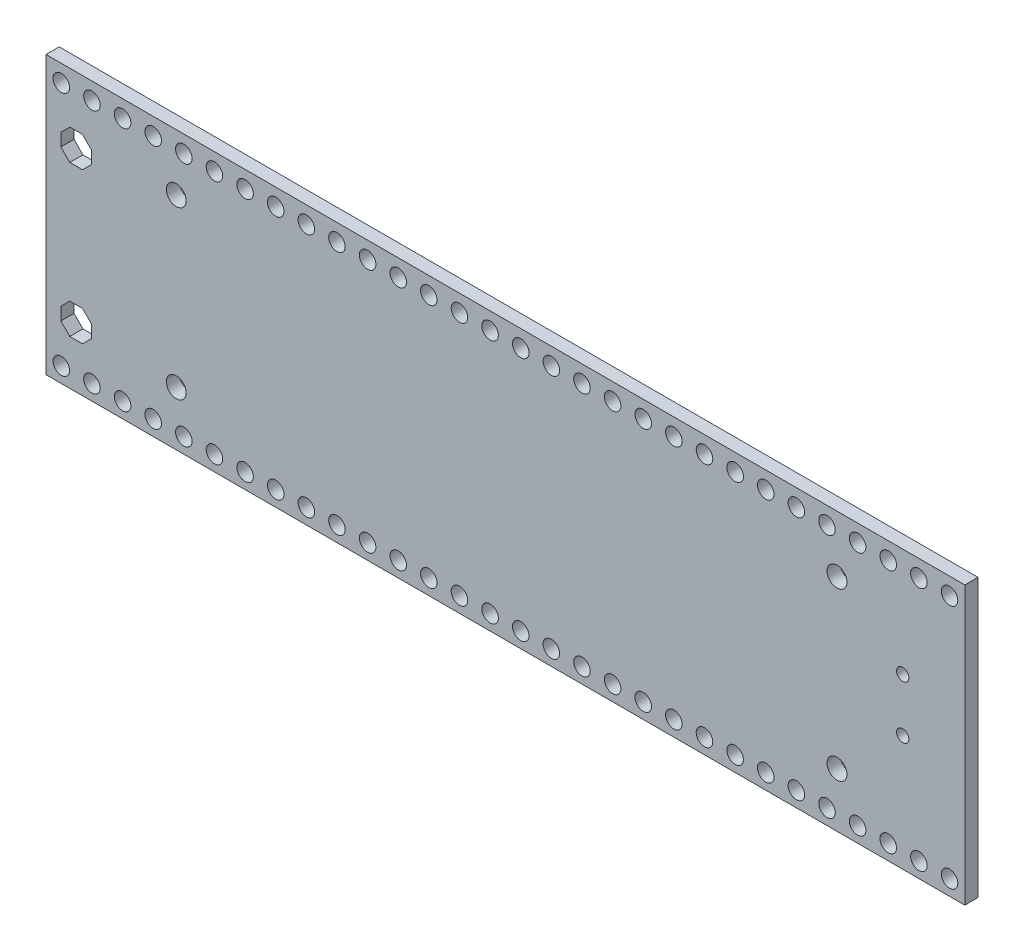
from build123d import *

# Parameters (mm, degrees)
MAIN_BOARD_DEPTH      = 0.5461
MAIN_BOARD_DEPTH_BACK = 0.5461
SKETCH1_W             = 76.2
SKETCH1_H             = 23.0000048
SKETCH1_R             = 0.6858
SKETCH1_R_2           = 0.824992
SKETCH1_R_3           = 0.508
SKETCH2_W             = 4.953
SKETCH2_H             = 4.953
BUTTONS_ON_BACK_DEPTH = 1.397
SKETCH3_W             = 5.4864
SKETCH3_H             = 9.7536
CHIP_ON_BACK_DEPTH    = 0.9398


with BuildPart() as part:
    # Sketch1 → Main board (new, two sides: drawn at the far end of the back side and taken through both)
    with BuildSketch(Plane.XY.offset(-MAIN_BOARD_DEPTH_BACK)):
        with Locations((38.1, 11.5000024)):
            Rectangle(SKETCH1_W, SKETCH1_H)
        with Locations((1.27, 21.59)):
            Circle(SKETCH1_R, mode=Mode.SUBTRACT)
        with Locations((3.81, 21.59)):
            Circle(SKETCH1_R, mode=Mode.SUBTRACT)
        with Locations((6.35, 21.59)):
            Circle(SKETCH1_R, mode=Mode.SUBTRACT)
        with Locations((8.89, 21.59)):
            Circle(SKETCH1_R, mode=Mode.SUBTRACT)
        with Locations((11.43, 21.59)):
            Circle(SKETCH1_R, mode=Mode.SUBTRACT)
        with Locations((13.97, 21.59)):
            Circle(SKETCH1_R, mode=Mode.SUBTRACT)
        with Locations((16.51, 21.59)):
            Circle(SKETCH1_R, mode=Mode.SUBTRACT)
        with Locations((19.05, 21.59)):
            Circle(SKETCH1_R, mode=Mode.SUBTRACT)
        with Locations((21.59, 21.59)):
            Circle(SKETCH1_R, mode=Mode.SUBTRACT)
        with Locations((24.13, 21.59)):
            Circle(SKETCH1_R, mode=Mode.SUBTRACT)
        with Locations((26.67, 21.59)):
            Circle(SKETCH1_R, mode=Mode.SUBTRACT)
        with Locations((29.21, 21.59)):
            Circle(SKETCH1_R, mode=Mode.SUBTRACT)
        with Locations((31.75, 21.59)):
            Circle(SKETCH1_R, mode=Mode.SUBTRACT)
        with Locations((34.29, 21.59)):
            Circle(SKETCH1_R, mode=Mode.SUBTRACT)
        with Locations((36.83, 21.59)):
            Circle(SKETCH1_R, mode=Mode.SUBTRACT)
        with Locations((39.37, 21.59)):
            Circle(SKETCH1_R, mode=Mode.SUBTRACT)
        with Locations((41.91, 21.59)):
            Circle(SKETCH1_R, mode=Mode.SUBTRACT)
        with Locations((44.45, 21.59)):
            Circle(SKETCH1_R, mode=Mode.SUBTRACT)
        with Locations((46.99, 21.59)):
            Circle(SKETCH1_R, mode=Mode.SUBTRACT)
        with Locations((49.53, 21.59)):
            Circle(SKETCH1_R, mode=Mode.SUBTRACT)
        with Locations((52.07, 21.59)):
            Circle(SKETCH1_R, mode=Mode.SUBTRACT)
        with Locations((54.61, 21.59)):
            Circle(SKETCH1_R, mode=Mode.SUBTRACT)
        with Locations((57.15, 21.59)):
            Circle(SKETCH1_R, mode=Mode.SUBTRACT)
        with Locations((59.69, 21.59)):
            Circle(SKETCH1_R, mode=Mode.SUBTRACT)
        with Locations((62.23, 21.59)):
            Circle(SKETCH1_R, mode=Mode.SUBTRACT)
        with Locations((64.77, 21.59)):
            Circle(SKETCH1_R, mode=Mode.SUBTRACT)
        with Locations((67.31, 21.59)):
            Circle(SKETCH1_R, mode=Mode.SUBTRACT)
        with Locations((69.85, 21.59)):
            Circle(SKETCH1_R, mode=Mode.SUBTRACT)
        with Locations((72.39, 21.59)):
            Circle(SKETCH1_R, mode=Mode.SUBTRACT)
        with Locations((74.93, 21.59)):
            Circle(SKETCH1_R, mode=Mode.SUBTRACT)
        with Locations((65.5999958, 18.2999888)):
            Circle(SKETCH1_R_2, mode=Mode.SUBTRACT)
        with Locations((65.5999958, 4.499991)):
            Circle(SKETCH1_R_2, mode=Mode.SUBTRACT)
        with Locations((10.8000038, 18.2999888)):
            Circle(SKETCH1_R_2, mode=Mode.SUBTRACT)
        with Locations((10.8000038, 4.499991)):
            Circle(SKETCH1_R_2, mode=Mode.SUBTRACT)
        with Locations((71.0499976, 13.9999974)):
            Circle(SKETCH1_R_3, mode=Mode.SUBTRACT)
        with Locations((71.0499976, 9.6000062)):
            Circle(SKETCH1_R_3, mode=Mode.SUBTRACT)
        with Locations((1.27, 1.27)):
            Circle(SKETCH1_R, mode=Mode.SUBTRACT)
        with Locations((3.81, 1.27)):
            Circle(SKETCH1_R, mode=Mode.SUBTRACT)
        with Locations((6.35, 1.27)):
            Circle(SKETCH1_R, mode=Mode.SUBTRACT)
        with Locations((8.89, 1.27)):
            Circle(SKETCH1_R, mode=Mode.SUBTRACT)
        with Locations((11.43, 1.27)):
            Circle(SKETCH1_R, mode=Mode.SUBTRACT)
        with Locations((13.97, 1.27)):
            Circle(SKETCH1_R, mode=Mode.SUBTRACT)
        with Locations((16.51, 1.27)):
            Circle(SKETCH1_R, mode=Mode.SUBTRACT)
        with Locations((19.05, 1.27)):
            Circle(SKETCH1_R, mode=Mode.SUBTRACT)
        with Locations((21.59, 1.27)):
            Circle(SKETCH1_R, mode=Mode.SUBTRACT)
        with Locations((24.13, 1.27)):
            Circle(SKETCH1_R, mode=Mode.SUBTRACT)
        with Locations((26.67, 1.27)):
            Circle(SKETCH1_R, mode=Mode.SUBTRACT)
        with Locations((29.21, 1.27)):
            Circle(SKETCH1_R, mode=Mode.SUBTRACT)
        with Locations((31.75, 1.27)):
            Circle(SKETCH1_R, mode=Mode.SUBTRACT)
        with Locations((34.29, 1.27)):
            Circle(SKETCH1_R, mode=Mode.SUBTRACT)
        with Locations((36.83, 1.27)):
            Circle(SKETCH1_R, mode=Mode.SUBTRACT)
        with Locations((39.37, 1.27)):
            Circle(SKETCH1_R, mode=Mode.SUBTRACT)
        with Locations((41.91, 1.27)):
            Circle(SKETCH1_R, mode=Mode.SUBTRACT)
        with Locations((44.45, 1.27)):
            Circle(SKETCH1_R, mode=Mode.SUBTRACT)
        with Locations((46.99, 1.27)):
            Circle(SKETCH1_R, mode=Mode.SUBTRACT)
        with Locations((49.53, 1.27)):
            Circle(SKETCH1_R, mode=Mode.SUBTRACT)
        with Locations((52.07, 1.27)):
            Circle(SKETCH1_R, mode=Mode.SUBTRACT)
        with Locations((54.61, 1.27)):
            Circle(SKETCH1_R, mode=Mode.SUBTRACT)
        with Locations((59.69, 1.27)):
            Circle(SKETCH1_R, mode=Mode.SUBTRACT)
        with Locations((57.15, 1.27)):
            Circle(SKETCH1_R, mode=Mode.SUBTRACT)
        with Locations((62.23, 1.27)):
            Circle(SKETCH1_R, mode=Mode.SUBTRACT)
        with Locations((64.77, 1.27)):
            Circle(SKETCH1_R, mode=Mode.SUBTRACT)
        with Locations((69.85, 1.27)):
            Circle(SKETCH1_R, mode=Mode.SUBTRACT)
        with Locations((67.31, 1.27)):
            Circle(SKETCH1_R, mode=Mode.SUBTRACT)
        with Locations((72.39, 1.27)):
            Circle(SKETCH1_R, mode=Mode.SUBTRACT)
        with Locations((74.93, 1.27)):
            Circle(SKETCH1_R, mode=Mode.SUBTRACT)
        Polygon((3.769995, 16.97393862), (3.769995, 18.02604218), (3.02604678, 18.7699904), (1.97394322, 18.7699904), (1.229995, 18.02604218), (1.229995, 16.97393862), (1.97394322, 16.2299904), (3.02604678, 16.2299904), align=None, mode=Mode.SUBTRACT)
        Polygon((3.769995, 4.47393822), (3.769995, 5.52604178), (3.02604678, 6.26999), (1.97394322, 6.26999), (1.229995, 5.52604178), (1.229995, 4.47393822), (1.97394322, 3.72999), (3.02604678, 3.72999), align=None, mode=Mode.SUBTRACT)
    extrude(amount=MAIN_BOARD_DEPTH + MAIN_BOARD_DEPTH_BACK)

    # Sketch2 → Buttons on back (add)
    with BuildSketch(Plane(origin=(0, 0, -0.5461), x_dir=(-1, 0, 0), z_dir=(0, 0, -1))):
        with Locations((-67.4243, 11.5573048)):
            Rectangle(SKETCH2_W, SKETCH2_H)
        with Locations((-60.0075, 14.7577048)):
            Rectangle(SKETCH2_W, SKETCH2_H)
        with Locations((-60.0075, 7.4295)):
            Rectangle(SKETCH2_W, SKETCH2_H)
    extrude(amount=BUTTONS_ON_BACK_DEPTH)

    # Sketch3 → Chip on back (add)
    with BuildSketch(Plane(origin=(0, 0, -0.5461), x_dir=(-1, 0, 0), z_dir=(0, 0, -1))):
        with Locations((-27.9908, 12.8908048)):
            Rectangle(SKETCH3_W, SKETCH3_H)
    extrude(amount=CHIP_ON_BACK_DEPTH)


solid = part.part
